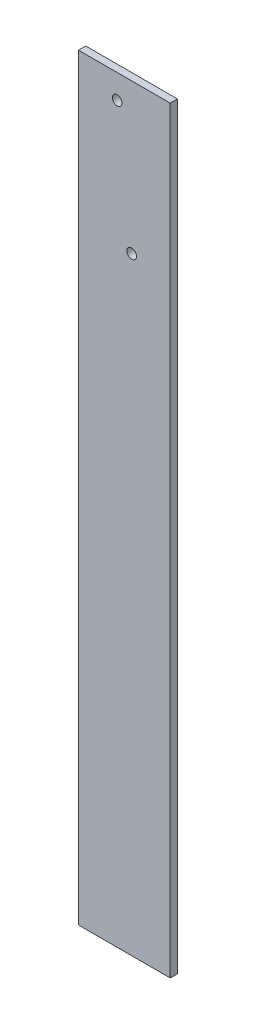
from build123d import *

# Parameters (mm, degrees)
ESQUISSE1_W             = 38
ESQUISSE1_H             = 314
BOSS_EXTRU_1_DEPTH      = 3
ENL_V_MAT_EXTRU_1_REACH = 192.418
ESQUISSE2_R             = 2


with BuildPart() as part:
    # Esquisse1 → Boss.-Extru.1 (new body)
    with BuildSketch(Plane.XY):
        with Locations((76, 8)):
            Rectangle(ESQUISSE1_W, ESQUISSE1_H)
    extrude(amount=BOSS_EXTRU_1_DEPTH)

    # Esquisse2 → Enlèv. mat.-Extru.1 (cut, up to next)
    with BuildSketch(Plane.XY.offset(3), mode=Mode.PRIVATE) as enl_v_mat_extru_1_sk1:
        with Locations((73, 155)):
            Circle(ESQUISSE2_R)
    enl_v_mat_extru_1_tool1 = extrude(enl_v_mat_extru_1_sk1.sketch, amount=-ENL_V_MAT_EXTRU_1_REACH, mode=Mode.PRIVATE) & part.part
    # Esquisse2 → Enlèv. mat.-Extru.1 (cut, up to next)
    with BuildSketch(Plane.XY.offset(3), mode=Mode.PRIVATE) as enl_v_mat_extru_1_sk2:
        with Locations((79, 103)):
            Circle(ESQUISSE2_R)
    enl_v_mat_extru_1_tool2 = extrude(enl_v_mat_extru_1_sk2.sketch, amount=-ENL_V_MAT_EXTRU_1_REACH, mode=Mode.PRIVATE) & part.part
    add(enl_v_mat_extru_1_tool1.solids().sort_by_distance((73, 155, 3))[0], mode=Mode.SUBTRACT)
    add(enl_v_mat_extru_1_tool2.solids().sort_by_distance((79, 103, 3))[0], mode=Mode.SUBTRACT)


solid = part.part
